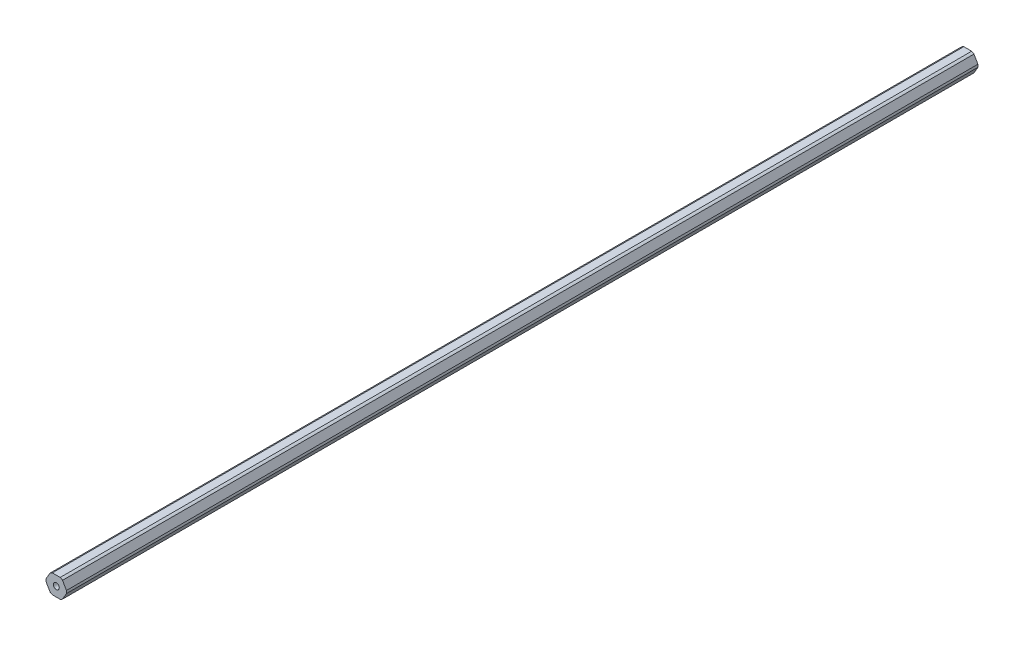
from build123d import *

# Parameters (mm, degrees)
SKETCH1_R           = 2.000000064
BOSS_EXTRUDE1_DEPTH = 609.6


with BuildPart() as part:
    # Sketch1 → Boss-Extrude1 (new body)
    with BuildSketch(Plane.XY):
        with BuildLine():
            ThreePointArc((4.181770846, 5.456960429), (3.437499983, 5.953924622), (2.634980936, 6.35))
            Line((2.634980936, 6.35), (-2.634980936, 6.35))
            ThreePointArc((-2.634980936, 6.35), (-3.437499983, 5.953924622), (-4.181770846, 5.456960429))
            Line((-4.181770846, 5.456960429), (-6.816751782, 0.893039571))
            ThreePointArc((-6.816751782, 0.893039571), (-6.874999966, 0), (-6.816751782, -0.893039571))
            Line((-6.816751782, -0.893039571), (-4.181770846, -5.456960429))
            ThreePointArc((-4.181770846, -5.456960429), (-3.437499983, -5.953924622), (-2.634980936, -6.35))
            Line((-2.634980936, -6.35), (2.634980936, -6.35))
            ThreePointArc((2.634980936, -6.35), (3.437499983, -5.953924622), (4.181770846, -5.456960429))
            Line((4.181770846, -5.456960429), (6.816751782, -0.893039571))
            ThreePointArc((6.816751782, -0.893039571), (6.860422465, -0.447468582), (6.874999966, 0))
            ThreePointArc((6.874999966, 0), (6.860422465, 0.447468582), (6.816751782, 0.893039571))
            Line((6.816751782, 0.893039571), (4.181770846, 5.456960429))
        make_face()
        with Locations(Location((0, 0, 0), (0, 0, 180))):
            Circle(SKETCH1_R, mode=Mode.SUBTRACT)
    extrude(amount=BOSS_EXTRUDE1_DEPTH)


solid = part.part
